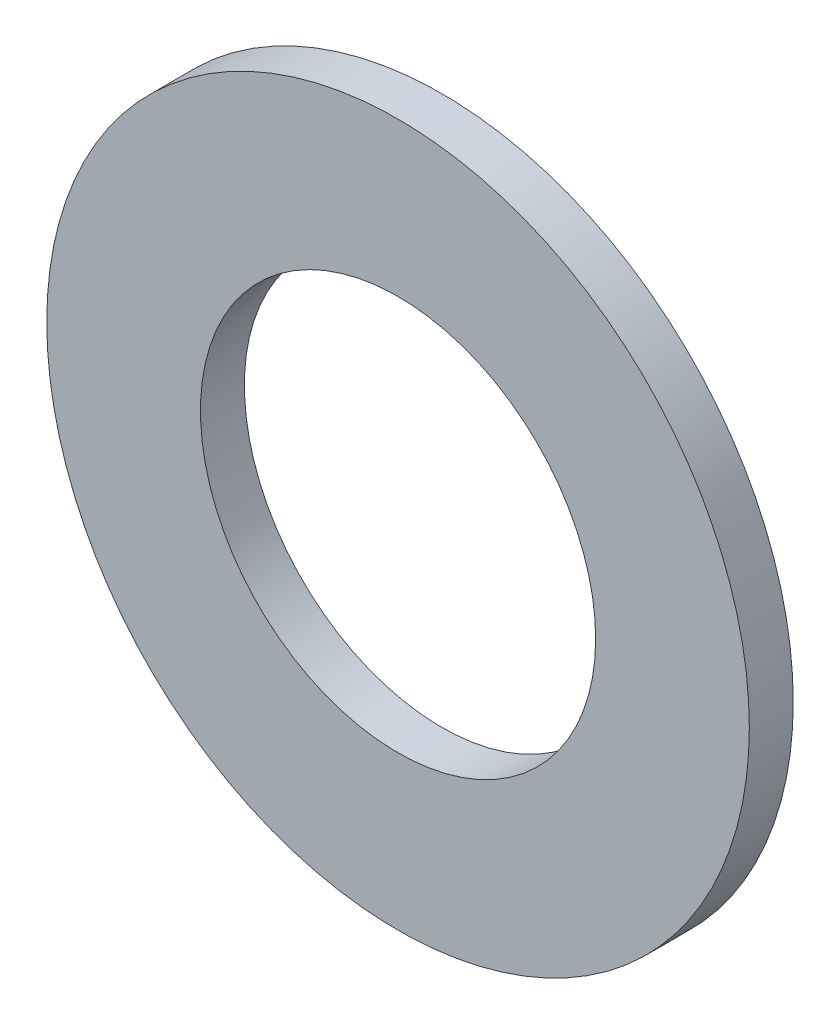
from build123d import *

# Parameters (mm, degrees)
SKETCH1_R           = 8
SKETCH1_R_2         = 4.5
BOSS_EXTRUDE1_DEPTH = 1


with BuildPart() as part:
    # Sketch1 → Boss-Extrude1 (new body)
    with BuildSketch(Plane.XY):
        Circle(SKETCH1_R)
        Circle(SKETCH1_R_2, mode=Mode.SUBTRACT)
    extrude(amount=BOSS_EXTRUDE1_DEPTH)


solid = part.part
